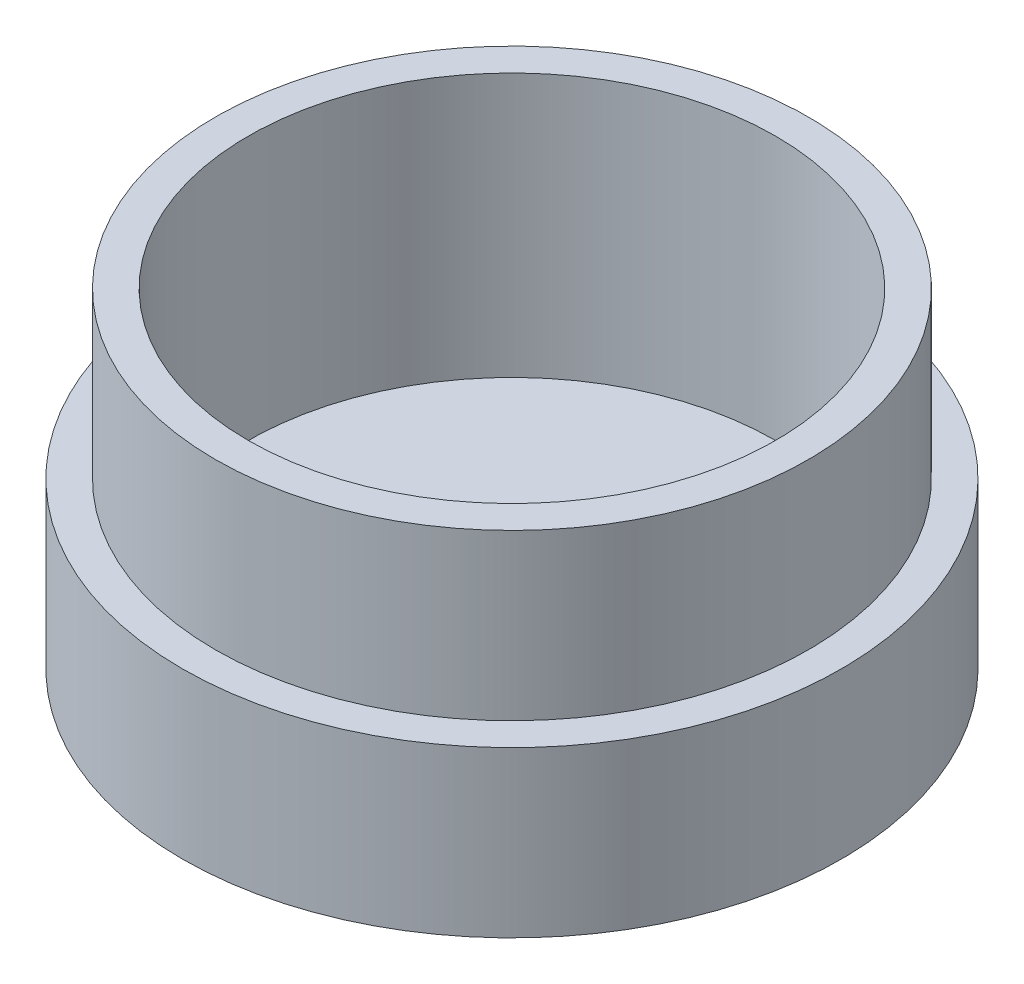
from build123d import *

# Parameters (mm, degrees)
SKETCH1_R           = 25.4
BOSS_EXTRUDE1_DEPTH = 25.4
SHELL2_T            = -5.08
CUT_EXTRUDE3_START  = -12.7
SKETCH3_R           = 25.4
SKETCH3_R_2         = 22.86
CUT_EXTRUDE3_DEPTH  = 12.7


with BuildPart() as part:
    # Sketch1 → Boss-Extrude1 (new body)
    with BuildSketch(Plane(origin=(0, 0, 0), x_dir=(1, 0, 0), z_dir=(0, 1, 0))):
        with Locations(Location((0, 0, 0), (0, 0, 270))):
            Circle(SKETCH1_R)
    extrude(amount=BOSS_EXTRUDE1_DEPTH)

    # Shell2
    shell2_openings = [part.faces().sort_by_distance(p)[0] for p in [
        (0, 25.4, 0),
    ]]
    offset(amount=SHELL2_T, openings=shell2_openings, kind=Kind.INTERSECTION)

    # Sketch3 → Cut-Extrude3 (cut)
    with BuildSketch(Plane(origin=(0, 25.4, 0), x_dir=(1, 0, 0), z_dir=(0, 1, 0)).offset(CUT_EXTRUDE3_START)):
        with Locations(Location((0, 0, 0), (0, 0, 270))):
            Circle(SKETCH3_R)
        with Locations(Location((0, 0, 0), (0, 0, 270))):
            Circle(SKETCH3_R_2, mode=Mode.SUBTRACT)
    extrude(amount=CUT_EXTRUDE3_DEPTH, mode=Mode.SUBTRACT)


solid = part.part
